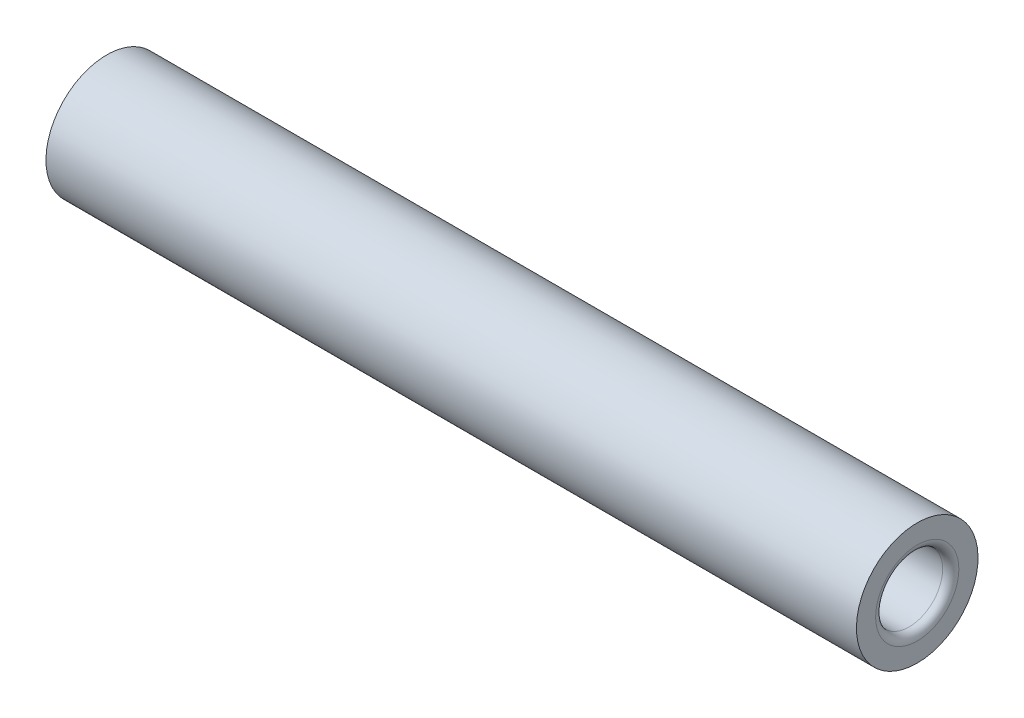
from build123d import *

# Parameters (mm, degrees)
FILLET1_R = 0.508


with BuildPart() as part:
    # Sketch1 → Revolve1 (revolve)
    with BuildSketch(Plane.XY):
        Polygon((0, 0), (0, 3.81), (50.8, 3.81), (50.8, 0), (37.892541774, 0), (12.907458226, 0), align=None)
    revolve(axis=Axis((0, 3.81, 0), (1, 0, 0)))

    # Sketch6 → Tap Drill for M4 Helicoil1 (revolve, cut)
    with BuildSketch(Plane.ZX.offset(3.81)):
        Polygon((0, 0), (0, 10.1518073), (2.1, 8.89), (2.1, 0), align=None)
    tap_drill_for_m4_helicoil1 = revolve(axis=Axis((-6.35, 3.81, 0), (1, 0, 0)), mode=Mode.SUBTRACT)

    # Mirror1: Tap Drill for M4 Helicoil1 across plane
    add(tap_drill_for_m4_helicoil1.mirror(Plane.ZY.offset(-25.4)), mode=Mode.SUBTRACT)

    # Fillet1
    fillet1_edges = [part.edges().sort_by_distance(p)[0] for p in [
        (0, 3.81, -2.1),
        (50.8, 3.81, -2.1),
    ]]
    fillet(fillet1_edges, radius=FILLET1_R)


solid = part.part
